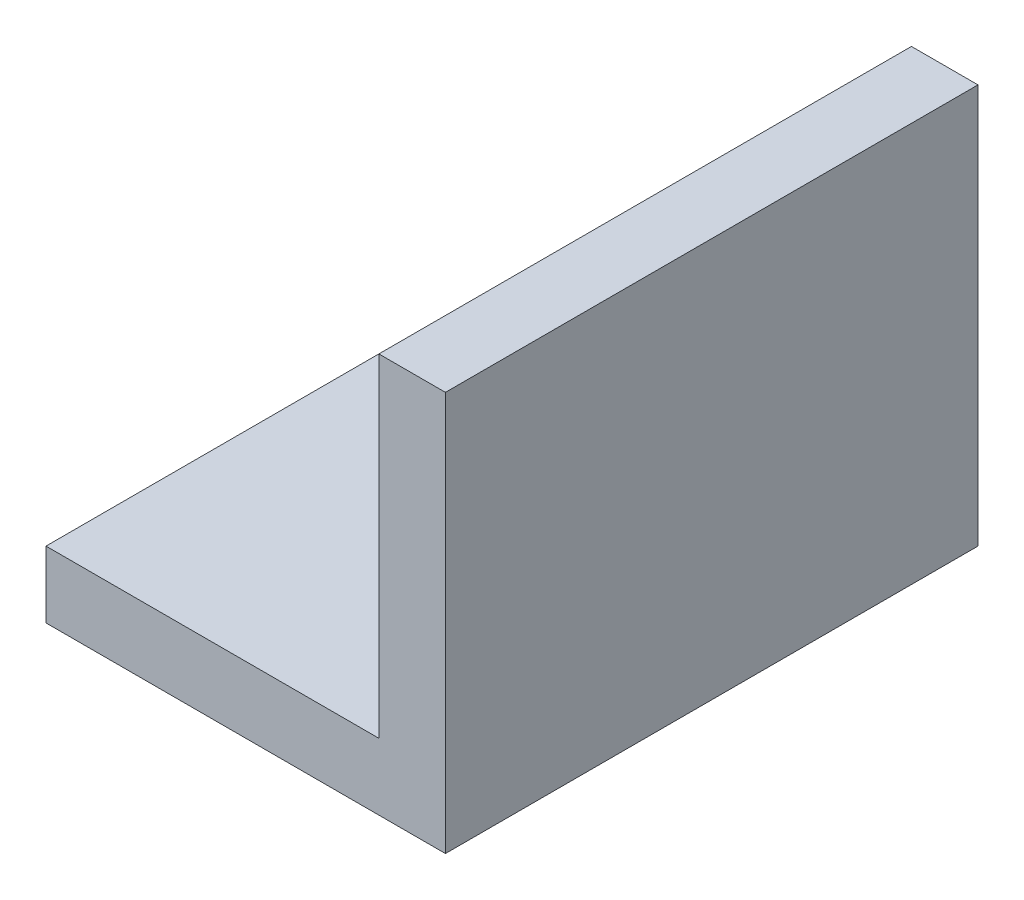
from build123d import *

# Parameters (mm, degrees)
BOSS_EXTRUDE1_DEPTH = 25.4


with BuildPart() as part:
    # Sketch1 → Boss-Extrude1 (new body)
    with BuildSketch(Plane.XY):
        Polygon((0, 0), (19.05, 0), (19.05, 19.05), (15.875, 19.05), (15.875, 3.175), (0, 3.175), align=None)
    extrude(amount=BOSS_EXTRUDE1_DEPTH)


solid = part.part
